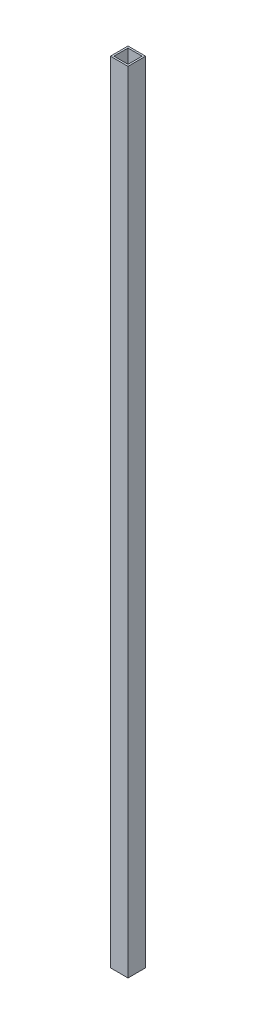
from build123d import *

# Parameters (mm, degrees)
SKETCH1_W           = 100
SKETCH1_H           = 100
BOSS_EXTRUDE1_DEPTH = 4482
SKETCH5_W           = 80
SKETCH5_H           = 80
CUT_EXTRUDE1_DEPTH  = 4485.230591751


with BuildPart() as part:
    # Sketch1 → Boss-Extrude1 (new body)
    with BuildSketch(Plane(origin=(0, 0, 0), x_dir=(1, 0, 0), z_dir=(0, 1, 0))):
        with Locations((50, 50)):
            Rectangle(SKETCH1_W, SKETCH1_H)
    extrude(amount=-BOSS_EXTRUDE1_DEPTH)

    # Sketch5 → Cut-Extrude1 (cut, through all)
    with BuildSketch(Plane(origin=(0, 0, 0), x_dir=(1, 0, 0), z_dir=(0, 1, 0))):
        with Locations((50, 50)):
            Rectangle(SKETCH5_W, SKETCH5_H)
    extrude(amount=-CUT_EXTRUDE1_DEPTH, mode=Mode.SUBTRACT)


solid = part.part
